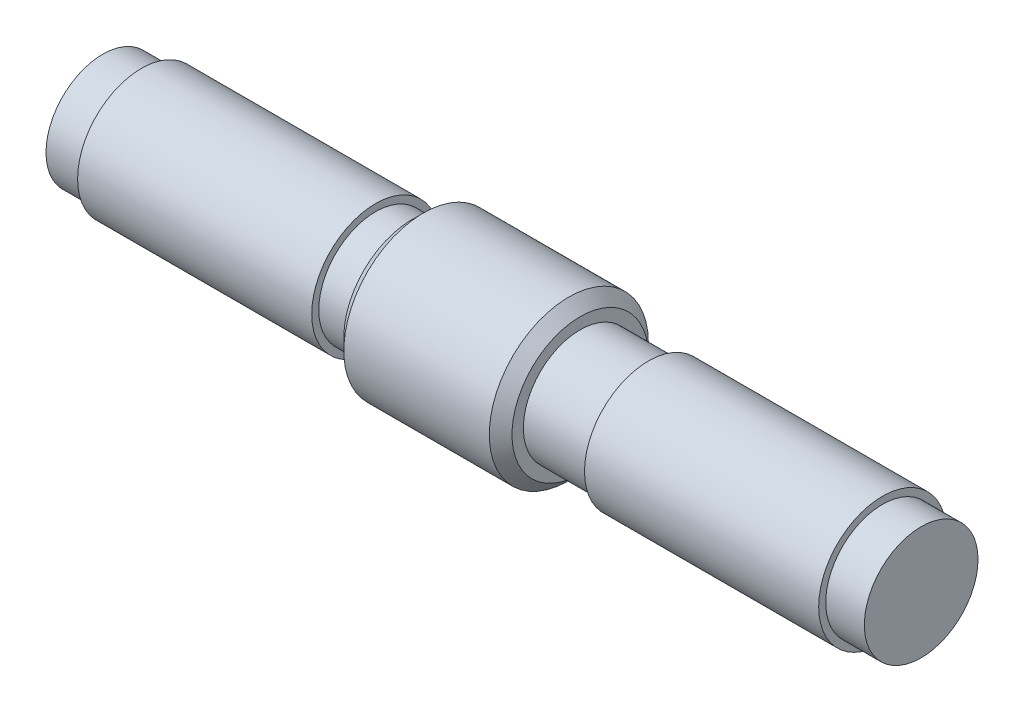
from build123d import *

# Parameters (mm, degrees)
CROQUIS1_R              = 35
SALIENTE_EXTRUIR1_DEPTH = 37
CHAFL_N1_SIZE           = 5
CROQUIS2_R              = 25
SALIENTE_EXTRUIR2_DEPTH = 16
CROQUIS3_R              = 28.1
SALIENTE_EXTRUIR3_DEPTH = 120
SALIENTE_EXTRUIR4_START = 30
CROQUIS4_R              = 25
SALIENTE_EXTRUIR4_DEPTH = 30
SALIENTE_EXTRUIR5_START = 120
CROQUIS5_R              = 28.1
SALIENTE_EXTRUIR5_DEPTH = 120
CORTAR_EXTRUIR1_START   = -17
CROQUIS6_R              = 28.1
CROQUIS6_R_2            = 25
CORTAR_EXTRUIR1_DEPTH   = 17
CROQUIS8_R              = 28.1
CROQUIS8_R_2            = 25
CORTAR_EXTRUIR2_DEPTH   = 17


with BuildPart() as part:
    # Croquis1 → Saliente-Extruir1 (new, symmetric)
    with BuildSketch(Plane(origin=(0, 0, 0), x_dir=(0, 0, -1), z_dir=(1, 0, 0))):
        Circle(CROQUIS1_R)
    extrude(amount=SALIENTE_EXTRUIR1_DEPTH, both=True)

    # Chaflán1
    chafl_n1_edges = [part.edges().sort_by_distance(p)[0] for p in [
        (-37, 0, 35),
        (37, 0, 35),
    ]]
    chamfer(chafl_n1_edges, length=CHAFL_N1_SIZE)

    # Croquis2 → Saliente-Extruir2 (add)
    with BuildSketch(Plane.ZY.offset(37)):
        Circle(CROQUIS2_R)
    extrude(amount=SALIENTE_EXTRUIR2_DEPTH)

    # Croquis3 → Saliente-Extruir3 (add)
    with BuildSketch(Plane.ZY.offset(53)):
        Circle(CROQUIS3_R)
    extrude(amount=SALIENTE_EXTRUIR3_DEPTH)

    # Croquis4 → Saliente-Extruir4 (add)
    with BuildSketch(Plane(origin=(37, 0, 0), x_dir=(0, 0, -1), z_dir=(1, 0, 0)).offset(SALIENTE_EXTRUIR4_START)):
        with Locations(Location((0, 0, 0), (0, 0, 180))):
            Circle(CROQUIS4_R)
    extrude(amount=-SALIENTE_EXTRUIR4_DEPTH)

    # Croquis5 → Saliente-Extruir5 (add)
    with BuildSketch(Plane(origin=(67, 0, 0), x_dir=(0, 0, -1), z_dir=(1, 0, 0)).offset(SALIENTE_EXTRUIR5_START)):
        with Locations(Location((0, 0, 0), (0, 0, 180))):
            Circle(CROQUIS5_R)
    extrude(amount=-SALIENTE_EXTRUIR5_DEPTH)

    # Croquis6 → Cortar-Extruir1 (cut)
    with BuildSketch(Plane.ZY.offset(173).offset(CORTAR_EXTRUIR1_START)):
        Circle(CROQUIS6_R)
        Circle(CROQUIS6_R_2, mode=Mode.SUBTRACT)
    extrude(amount=CORTAR_EXTRUIR1_DEPTH, mode=Mode.SUBTRACT)

    # Croquis8 → Cortar-Extruir2 (cut)
    with BuildSketch(Plane(origin=(187, 0, 0), x_dir=(0, 0, -1), z_dir=(1, 0, 0))):
        with Locations(Location((0, 0, 0), (0, 0, 180))):
            Circle(CROQUIS8_R)
        with Locations(Location((0, 0, 0), (0, 0, 180))):
            Circle(CROQUIS8_R_2, mode=Mode.SUBTRACT)
    extrude(amount=-CORTAR_EXTRUIR2_DEPTH, mode=Mode.SUBTRACT)


solid = part.part
